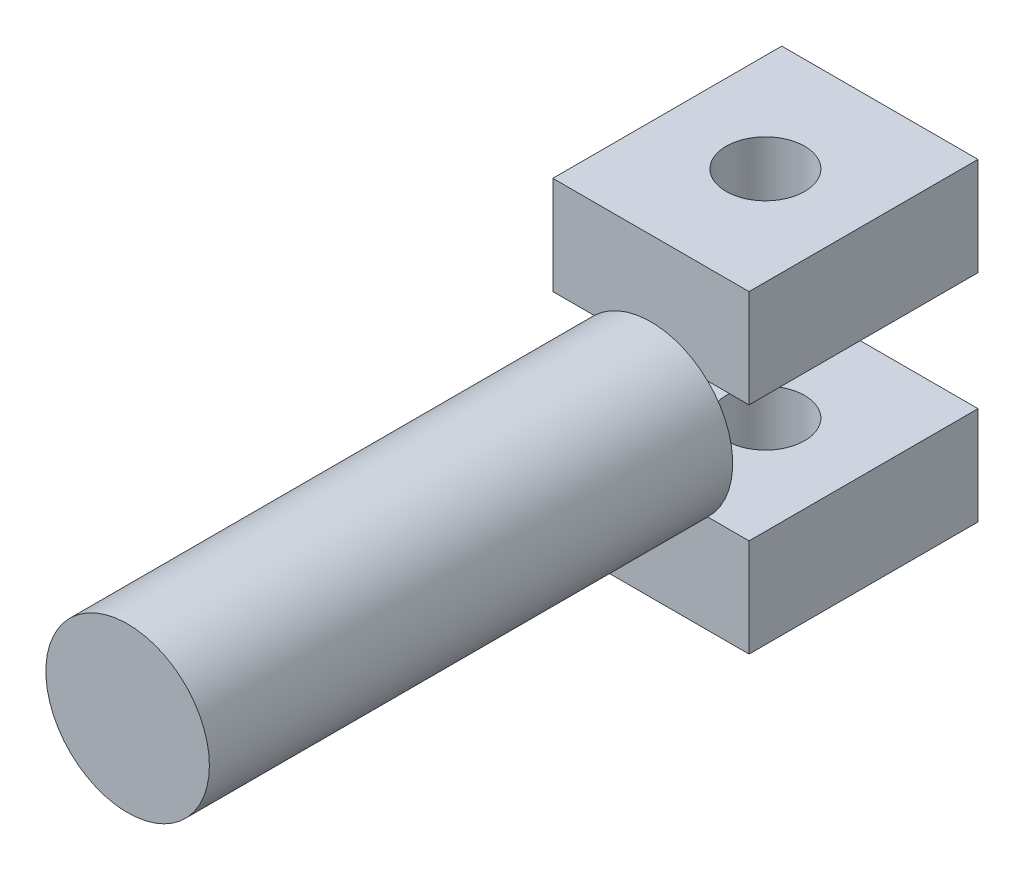
from build123d import *

# Parameters (mm, degrees)
ESQUISSE1_R                  = 12.5
BOSS_EXTRU_1_DEPTH           = 80
BOSS_EXTRU_2_DEPTH           = 2.5
BOSS_EXTRU_2_DEPTH_BACK      = 27.5
ESQUISSE2_W                  = 35
ESQUISSE2_H                  = 48
ENL_V_MAT_EXTRU_1_DEPTH      = 89.746830929
ENL_V_MAT_EXTRU_1_DEPTH_BACK = 89.746830929
ESQUISSE3_W                  = 35
ESQUISSE3_H                  = 18
ENL_V_MAT_EXTRU_2_DEPTH      = 95.493386012
ENL_V_MAT_EXTRU_2_DEPTH_BACK = 95.493386012
ESQUISSE4_R                  = 6


with BuildPart() as part:
    # Esquisse1 → Boss.-Extru.1 (new body)
    with BuildSketch(Plane.XY):
        Circle(ESQUISSE1_R)
    extrude(amount=BOSS_EXTRU_1_DEPTH)

    # Esquisse2 → Boss.-Extru.2 (add, two sides: drawn at the far end of the back side and taken through both)
    with BuildSketch(Plane.ZY.offset(12.5).offset(-BOSS_EXTRU_2_DEPTH_BACK)):
        with Locations((-17.5, 0)):
            Rectangle(ESQUISSE2_W, ESQUISSE2_H)
    extrude(amount=BOSS_EXTRU_2_DEPTH + BOSS_EXTRU_2_DEPTH_BACK)

    # Esquisse3 → Enlèv. mat.-Extru.1 (cut, two sides: drawn at the far end of the back side and taken through both)
    with BuildSketch(Plane.ZY.offset(15).offset(-ENL_V_MAT_EXTRU_1_DEPTH_BACK)):
        with Locations((-17.5, 0)):
            Rectangle(ESQUISSE3_W, ESQUISSE3_H)
    extrude(amount=ENL_V_MAT_EXTRU_1_DEPTH + ENL_V_MAT_EXTRU_1_DEPTH_BACK, mode=Mode.SUBTRACT)

    # Esquisse4 → Enlèv. mat.-Extru.2 (cut, two sides: drawn at the far end of the back side and taken through both)
    with BuildSketch(Plane.XZ.offset(24).offset(-ENL_V_MAT_EXTRU_2_DEPTH_BACK)):
        with Locations((0, -17.5)):
            Circle(ESQUISSE4_R)
    extrude(amount=ENL_V_MAT_EXTRU_2_DEPTH + ENL_V_MAT_EXTRU_2_DEPTH_BACK, mode=Mode.SUBTRACT)


solid = part.part
